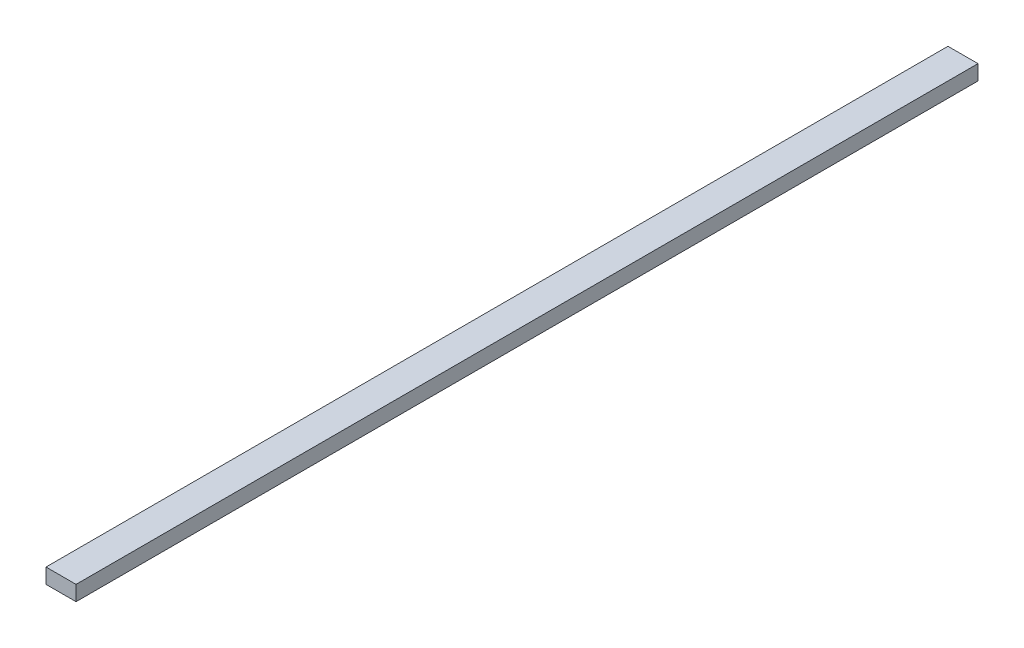
from build123d import *

# Parameters (mm, degrees)
SKETCH1_W           = 9.991791187
SKETCH1_H           = 300
BOSS_EXTRUDE1_DEPTH = 5


with BuildPart() as part:
    # Sketch1 → Boss-Extrude1 (new body)
    with BuildSketch(Plane(origin=(0, 0, 0), x_dir=(1, 0, 0), z_dir=(0, 1, 0))):
        with Locations((4.995895594, -84.896857942)):
            Rectangle(SKETCH1_W, SKETCH1_H)
    extrude(amount=BOSS_EXTRUDE1_DEPTH)


solid = part.part
